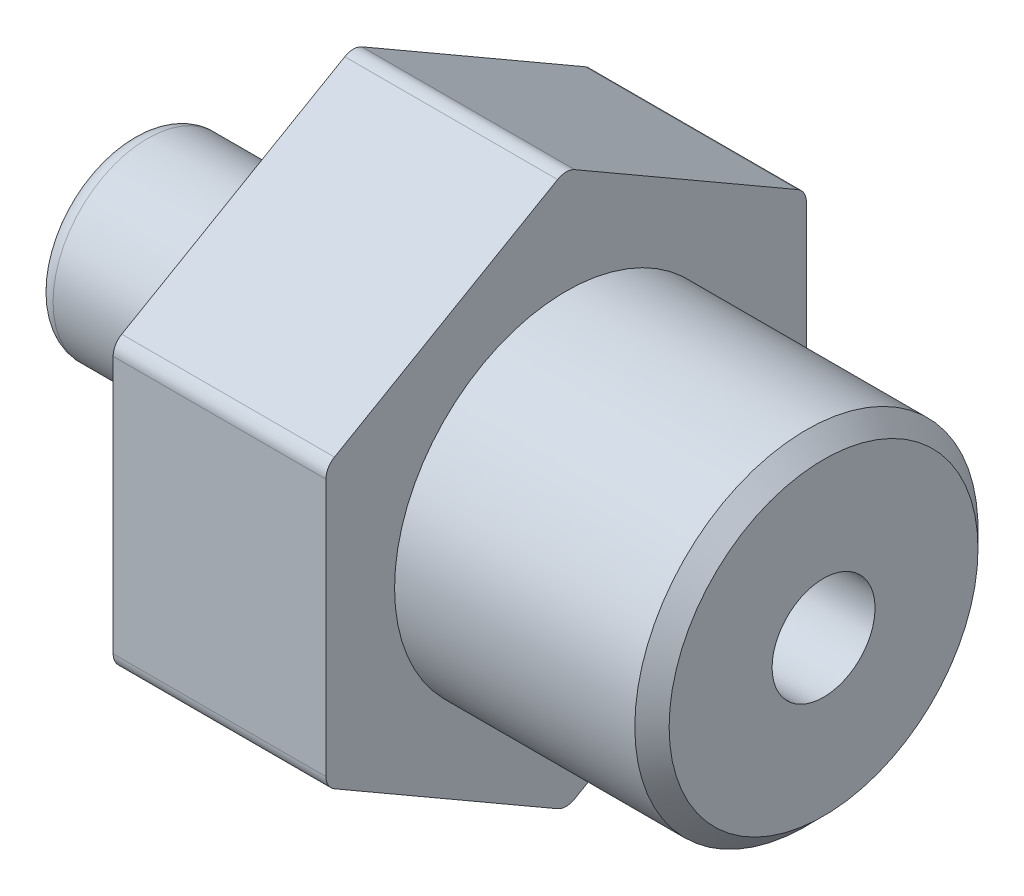
from build123d import *

# Parameters (mm, degrees)
SKETCH_1_W      = 7.5
SKETCH_1_H      = 3.5
SKETCH_2_R      = 3
EXTRUDE_1_DEPTH = 6.2
SKETCH_3_R      = 2.75
SKETCH_3_R_2    = 1.5
EXTRUDE_2_DEPTH = 6.5
FILLET_2_R      = 0.5
CHAMFER_1_SIZE  = 0.5
FILLET_3_R      = 0.5


with BuildPart() as part:
    # Эскиз1 → Повернуть1 (revolve)
    with BuildSketch(Plane.XY, mode=Mode.PRIVATE) as revolve_1_sk:
        with Locations((3.75, 3.25)):
            Rectangle(SKETCH_1_W, SKETCH_1_H)
    revolve(revolve_1_sk.sketch.rotate(Axis((0, 0, 0), (1, 0, 0)), 90), axis=Axis((0, 0, 0), (1, 0, 0)))

    # Эскиз2 → Бобышка-Вытянуть1 (add)
    with BuildSketch(Plane.ZY):
        Polygon((0, 8.082903769), (-7, 4.041451884), (-7, -4.041451884), (0, -8.082903769), (7, -4.041451884), (7, 4.041451884), align=None)
        with Locations(Location((0, 0, 0), (0, 0, 180))):
            Circle(SKETCH_2_R, mode=Mode.SUBTRACT)
    extrude(amount=EXTRUDE_1_DEPTH)

    # Фаска1
    chamfer_1_edges = [part.edges().sort_by_distance(p)[0] for p in [
        (7.5, 0, -5),
    ]]
    chamfer(chamfer_1_edges, length=CHAMFER_1_SIZE)

    # Скругление3
    fillet_3_edges = [part.edges().sort_by_distance(p)[0] for p in [
        (-3.1, 4.041451884, 7),
        (-3.1, 8.082903769, 0),
        (-3.1, 4.041451884, -7),
        (-3.1, -4.041451884, -7),
        (-3.1, -8.082903769, 0),
        (-3.1, -4.041451884, 7),
    ]]
    fillet(fillet_3_edges, radius=FILLET_3_R)


with BuildPart() as body_2:
    # Эскиз3 → Бобышка-Вытянуть2 (new body)
    with BuildSketch(Plane.ZY.offset(6.2)):
        with Locations(Location((0, 0, 0), (0, 0, 180))):
            Circle(SKETCH_3_R)
        with Locations(Location((0, 0, 0), (0, 0, 180))):
            Circle(SKETCH_3_R_2, mode=Mode.SUBTRACT)
    extrude(amount=EXTRUDE_2_DEPTH)

    # Скругление2
    fillet_2_edges = [body_2.edges().sort_by_distance(p)[0] for p in [
        (-12.7, 0, 2.75),
    ]]
    fillet(fillet_2_edges, radius=FILLET_2_R)


solid = Compound([part.part, body_2.part])
